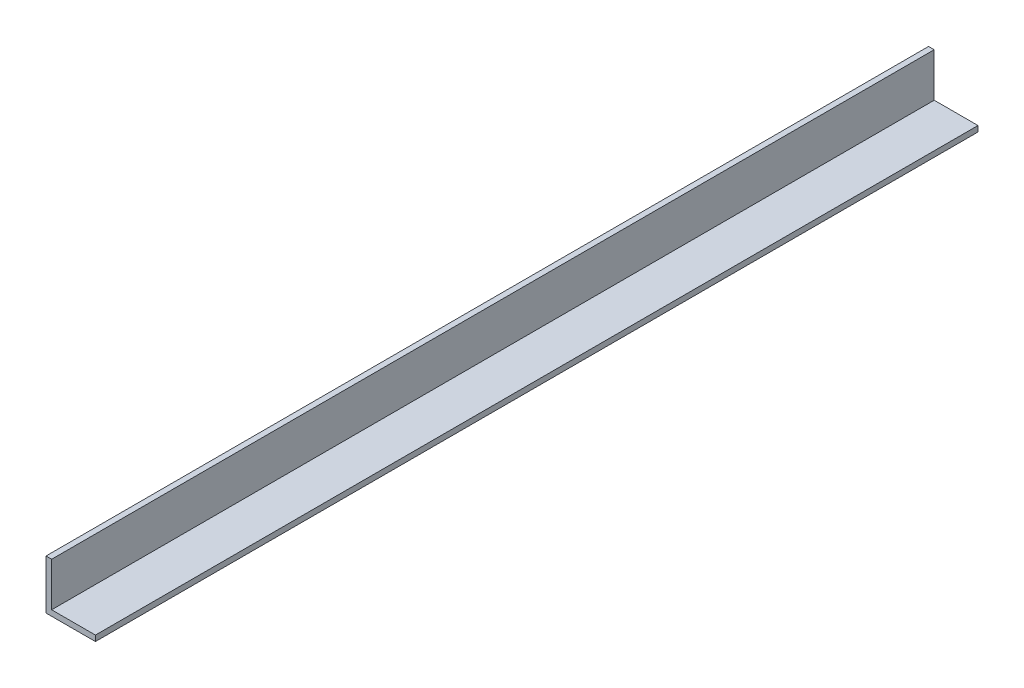
from build123d import *

# Parameters (mm, degrees)
EXTRUDE_1_DEPTH = 1250


with BuildPart() as part:
    # Эскиз1 → Бобышка-Вытянуть1 (new body)
    with BuildSketch(Plane.XY):
        Polygon((-35, 70), (-35, 0), (35, 0), (35, 8), (-27, 8), (-27, 70), align=None)
    extrude(amount=EXTRUDE_1_DEPTH)


solid = part.part
